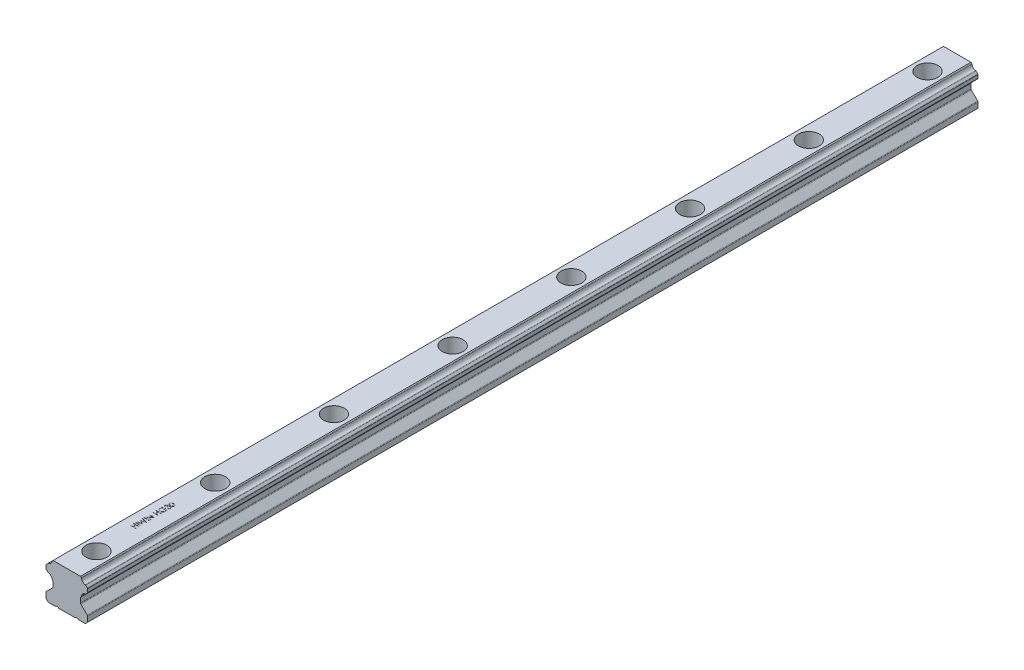
from build123d import *

# Parameters (mm, degrees)
EXTRUDE_1_DEPTH              = 600
HOLE_WIZARD_M8_1_D           = 9
HOLE_WIZARD_M8_1_CBORE_D     = 14
HOLE_WIZARD_M8_1_CBORE_DEPTH = 12
PATTERN_LINEAR_1_COUNT       = 8
PATTERN_LINEAR_1_PITCH       = 80
SKETCH_6_W                   = 3.5
SKETCH_6_H                   = 0.314102564
CUT_EXTRUDE_1_DEPTH          = 0.1


with BuildPart() as part:
    # 草图1 → 凸台-拉伸1 (new body)
    with BuildSketch(Plane.XY):
        with BuildLine():
            Line((13.824264069, 21.431566452), (12.716556587, 22.539273934))
            ThreePointArc((12.716556587, 22.539273934), (12.556614589, 22.653650602), (12.368284792, 22.710178055))
            ThreePointArc((12.368284792, 22.710178055), (10.725602827, 23.516275827), (9.919505055, 25.158957792))
            ThreePointArc((9.919505055, 25.158957792), (9.862977602, 25.347287589), (9.748600934, 25.507229587))
            Line((9.748600934, 25.507229587), (9.255830521, 26))
            Line((9.255830521, 26), (-9.255830521, 26))
            Line((-9.255830521, 26), (-9.748600934, 25.507229587))
            ThreePointArc((-9.748600934, 25.507229587), (-9.862977602, 25.347287589), (-9.919505055, 25.158957792))
            ThreePointArc((-9.919505055, 25.158957792), (-10.725602827, 23.516275827), (-12.368284792, 22.710178055))
            ThreePointArc((-12.368284792, 22.710178055), (-12.556614589, 22.653650602), (-12.716556587, 22.539273934))
            Line((-12.716556587, 22.539273934), (-13.824264069, 21.431566452))
            ThreePointArc((-13.824264069, 21.431566452), (-13.95432772, 21.236912443), (-14, 21.007302383))
            Line((-14, 21.007302383), (-14, 18.986847592))
            ThreePointArc((-14, 18.986847592), (-13.95432772, 18.757237533), (-13.824264069, 18.562583524))
            Line((-13.824264069, 18.562583524), (-12.722974973, 17.461294428))
            ThreePointArc((-12.722974973, 17.461294428), (-12.562524861, 17.346668715), (-12.373580428, 17.290248027))
            ThreePointArc((-12.373580428, 17.290248027), (-10.725602827, 16.483479173), (-9.918833973, 14.835501572))
            ThreePointArc((-9.918833973, 14.835501572), (-9.862413285, 14.646557139), (-9.747787572, 14.486107027))
            Line((-9.747787572, 14.486107027), (-9.534314575, 14.27263403))
            ThreePointArc((-9.534314575, 14.27263403), (-9.360896374, 14.013095351), (-9.3, 13.706948605))
            Line((-9.3, 13.706948605), (-9.3, 10.472470505))
            ThreePointArc((-9.3, 10.472470505), (-9.360896374, 10.166323759), (-9.534314575, 9.90678508))
            Line((-9.534314575, 9.90678508), (-13.765685425, 5.67541423))
            ThreePointArc((-13.765685425, 5.67541423), (-13.939103626, 5.415875551), (-14, 5.109728805))
            Line((-14, 5.109728805), (-14, 1.5))
            Line((-14, 1.5), (-12.5, 0))
            Line((-12.5, 0), (-7.75, 0))
            Line((-7.75, 0), (-7.25, 0.5))
            Line((-7.25, 0.5), (-6.05, 0.5))
            Line((-6.05, 0.5), (-5.55, 0))
            Line((-5.55, 0), (5.55, 0))
            Line((5.55, 0), (6.05, 0.5))
            Line((6.05, 0.5), (7.25, 0.5))
            Line((7.25, 0.5), (7.75, 0))
            Line((7.75, 0), (12.5, 0))
            Line((12.5, 0), (14, 1.5))
            Line((14, 1.5), (14, 5.109728805))
            ThreePointArc((14, 5.109728805), (13.939103626, 5.415875551), (13.765685425, 5.67541423))
            Line((13.765685425, 5.67541423), (9.534314575, 9.90678508))
            ThreePointArc((9.534314575, 9.90678508), (9.360896374, 10.166323759), (9.3, 10.472470505))
            Line((9.3, 10.472470505), (9.3, 13.706948605))
            ThreePointArc((9.3, 13.706948605), (9.360896374, 14.013095351), (9.534314575, 14.27263403))
            Line((9.534314575, 14.27263403), (9.747787572, 14.486107027))
            ThreePointArc((9.747787572, 14.486107027), (9.862413285, 14.646557139), (9.918833973, 14.835501572))
            ThreePointArc((9.918833973, 14.835501572), (10.725602827, 16.483479173), (12.373580428, 17.290248027))
            ThreePointArc((12.373580428, 17.290248027), (12.562524861, 17.346668715), (12.722974973, 17.461294428))
            Line((12.722974973, 17.461294428), (13.824264069, 18.562583524))
            ThreePointArc((13.824264069, 18.562583524), (13.95432772, 18.757237533), (14, 18.986847592))
            Line((14, 18.986847592), (14, 21.007302383))
            ThreePointArc((14, 21.007302383), (13.95432772, 21.236912443), (13.824264069, 21.431566452))
        make_face()
    extrude(amount=-EXTRUDE_1_DEPTH)

    # M8 六角凹头螺钉的柱形沉头孔1 (through all)
    with Locations(Plane(origin=(-4.520582573, 26, -44.994906709), x_dir=(-1, 0, 0), z_dir=(0, 1, 0))):
        with Locations((-4.520582573, 24.994906709)):
            hole_wizard_m8_1 = CounterBoreHole(HOLE_WIZARD_M8_1_D / 2, HOLE_WIZARD_M8_1_CBORE_D / 2, HOLE_WIZARD_M8_1_CBORE_DEPTH)

    # 阵列(线性)1: M8 六角凹头螺钉的柱形沉头孔1 ×8
    with Locations(*[(0, 0, -i * PATTERN_LINEAR_1_PITCH) for i in range(1, PATTERN_LINEAR_1_COUNT)]):
        add(hole_wizard_m8_1, mode=Mode.SUBTRACT)

    # 草图6 → 切除-拉伸1 (cut)
    # profile 1 of 9: a face of its own
    with BuildSketch(Plane(origin=(0, 26, 0), x_dir=(1, 0, 0), z_dir=(0, 1, 0))):
        Polygon((-3.5, 46.403846154), (-3.5, 46.717948718), (-2.064102564, 46.717948718), (-2.064102564, 48.512820513), (-3.5, 48.512820513), (-3.5, 48.826923077), (0, 48.826923077), (0, 48.512820513), (-1.705128205, 48.512820513), (-1.705128205, 46.717948718), (0, 46.717948718), (0, 46.403846154), align=None)
    # profile 2 of 9: a face of its own
    with BuildSketch(Plane(origin=(0, 26, 0), x_dir=(1, 0, 0), z_dir=(0, 1, 0))):
        with Locations((-1.75, 49.881410256)):
            Rectangle(SKETCH_6_W, SKETCH_6_H)
    # profile 3 of 9: a face of its own
    with BuildSketch(Plane(origin=(0, 26, 0), x_dir=(1, 0, 0), z_dir=(0, 1, 0))):
        Polygon((-3.5, 50.576923077), (-3.5, 50.901542468), (-0.933193109, 51.586538462), (-3.5, 52.605268429), (-3.5, 52.650841346), (-0.950721154, 53.650641026), (-3.5, 54.339142628), (-3.5, 54.66025641), (0, 53.716546474), (0, 53.671674679), (-2.676883013, 52.618589744), (0, 51.552884615), (0, 51.508012821), align=None)
    # profile 4 of 9: a face of its own
    with BuildSketch(Plane(origin=(0, 26, 0), x_dir=(1, 0, 0), z_dir=(0, 1, 0))):
        with Locations((-1.75, 55.625)):
            Rectangle(SKETCH_6_W, SKETCH_6_H)
    # profile 5 of 9: a face of its own
    with BuildSketch(Plane(origin=(0, 26, 0), x_dir=(1, 0, 0), z_dir=(0, 1, 0))):
        Polygon((0, 56.544871795), (-3.5, 56.544871795), (-3.5, 56.610777244), (-0.745292468, 58.923076923), (-3.5, 58.923076923), (-3.5, 59.237179487), (0, 59.237179487), (0, 59.165665064), (-2.748397436, 56.858974359), (0, 56.858974359), align=None)
    # profile 6 of 9: a face of its own
    with BuildSketch(Plane(origin=(0, 26, 0), x_dir=(1, 0, 0), z_dir=(0, 1, 0))):
        Polygon((-3.5, 61.480769231), (-3.5, 61.794871795), (-2.064102564, 61.794871795), (-2.064102564, 63.58974359), (-3.5, 63.58974359), (-3.5, 63.903846154), (0, 63.903846154), (0, 63.58974359), (-1.705128205, 63.58974359), (-1.705128205, 61.794871795), (0, 61.794871795), (0, 61.480769231), align=None)
    # profile 7 of 9: a face of its own
    with BuildSketch(Plane(origin=(0, 26, 0), x_dir=(1, 0, 0), z_dir=(0, 1, 0))):
        with BuildLine():
            Line((-2.902644231, 68.076923077), (-2.647435897, 67.807692308))
            add(Edge.make_bspline(
                [(-2.647435897, 67.807692308), (-2.69328212, 67.758983227), (-2.783881335, 67.662726562), (-2.901244074, 67.50552662), (-3.002777003, 67.342170767), (-3.084772592, 67.172394867), (-3.149094254, 67.000650867), (-3.195850217, 66.829891913), (-3.225460377, 66.661223615), (-3.229016796, 66.549059313), (-3.230769231, 66.493790064)],
                knots=[0, 0, 0, 0, 1.089067066, 2.152164705, 3.18986567, 4.218445106, 5.218487318, 6.173592265, 7.100032889, 8, 8, 8, 8], degree=3))
            add(Edge.make_bspline(
                [(-3.230769231, 66.493790064), (-3.230355625, 66.459875364), (-3.229529486, 66.392133924), (-3.218985271, 66.29151198), (-3.203820407, 66.191945342), (-3.181878529, 66.093621968), (-3.15406947, 65.99635068), (-3.119284004, 65.900469793), (-3.078728771, 65.805800421), (-3.031866252, 65.713234402), (-2.980386575, 65.623493669), (-2.923337414, 65.538737672), (-2.862550889, 65.458421211), (-2.796491613, 65.384072004), (-2.725807311, 65.31519549), (-2.651770944, 65.250524789), (-2.572926872, 65.191265211), (-2.489599321, 65.138479571), (-2.403726867, 65.090811977), (-2.316037795, 65.049619777), (-2.227346143, 65.013809823), (-2.136984078, 64.986535862), (-2.045883197, 64.963434988), (-1.953566086, 64.947353752), (-1.859791669, 64.938257435), (-1.796993971, 64.936686944), (-1.765424679, 64.935897436)],
                knots=[0, 0, 0, 0, 1.028150113, 2.053633673, 3.06513288, 4.081487945, 5.106702018, 6.131327874, 7.172780699, 8.228344599, 9.276313556, 10.308389736, 11.324843658, 12.329040066, 13.321460474, 14.316307835, 15.308626991, 16.309440696, 17.305625405, 18.28535951, 19.246194545, 20.203493668, 21.145557131, 22.095268976, 23.042464743, 24, 24, 24, 24], degree=3))
            add(Edge.make_bspline(
                [(-1.765424679, 64.935897436), (-1.733154018, 64.936653631), (-1.668700816, 64.938163957), (-1.572504414, 64.947817154), (-1.477747832, 64.965772364), (-1.384282029, 64.989584114), (-1.291920993, 65.019856789), (-1.20076111, 65.057049303), (-1.110811241, 65.101355435), (-1.022964324, 65.152526704), (-0.937464192, 65.209036172), (-0.856251713, 65.271187356), (-0.780271995, 65.339084893), (-0.708415252, 65.411483836), (-0.641134974, 65.489043832), (-0.579242122, 65.572517364), (-0.521779643, 65.660735956), (-0.469378807, 65.753738745), (-0.42257144, 65.850542725), (-0.38094723, 65.949799156), (-0.346667976, 66.051827058), (-0.31872985, 66.156089724), (-0.295829559, 66.262463002), (-0.281097077, 66.371486803), (-0.270406246, 66.482359512), (-0.269624576, 66.557098144), (-0.269230769, 66.594751603)],
                knots=[0, 0, 0, 0, 0.935915162, 1.869274651, 2.799799983, 3.730201895, 4.664668062, 5.616159355, 6.583070886, 7.570012957, 8.562524459, 9.553461134, 10.53281078, 11.515274572, 12.509912756, 13.507571325, 14.526460018, 15.561318395, 16.601025881, 17.643204557, 18.680545676, 19.719612342, 20.772381578, 21.833430283, 22.908478249, 24, 24, 24, 24], degree=3))
            add(Edge.make_bspline(
                [(-0.269230769, 66.594751603), (-0.270178952, 66.640130135), (-0.272040863, 66.729238255), (-0.286546735, 66.860222075), (-0.309173205, 66.986034693), (-0.342412256, 67.106266531), (-0.384484705, 67.221353926), (-0.436513285, 67.330872414), (-0.497950569, 67.435124408), (-0.567552463, 67.533658668), (-0.645100929, 67.624132689), (-0.728035637, 67.706474768), (-0.817431068, 67.77785339), (-0.911954918, 67.840400707), (-1.012511326, 67.892097951), (-1.118540888, 67.934543829), (-1.230109213, 67.967076285), (-1.307200733, 67.980431374), (-1.346153846, 67.987179487)],
                knots=[0, 0, 0, 0, 1.130199668, 2.219330667, 3.279027493, 4.311506524, 5.322739849, 6.327972234, 7.327472899, 8.33386792, 9.329086447, 10.29244429, 11.240784345, 12.174119183, 13.111530729, 14.052100829, 15.015757696, 16, 16, 16, 16], degree=3))
            Line((-1.346153846, 67.987179487), (-1.346153846, 66.820512821))
            Line((-1.346153846, 66.820512821), (-1.705128205, 66.820512821))
            Line((-1.705128205, 66.820512821), (-1.705128205, 68.301282051))
            add(Edge.make_bspline(
                [(-1.705128205, 68.301282051), (-1.638220716, 68.299576203), (-1.507270675, 68.296237549), (-1.316300404, 68.272818634), (-1.13592871, 68.235002122), (-0.965965639, 68.18334181), (-0.806652046, 68.116466529), (-0.65782618, 68.035094001), (-0.520449499, 67.93792188), (-0.393400495, 67.828411438), (-0.280071283, 67.705511481), (-0.180465345, 67.572542861), (-0.09656273, 67.429285892), (-0.028302067, 67.275876085), (0.024971927, 67.112815651), (0.062743504, 66.939727272), (0.085373467, 66.756845671), (0.088264847, 66.631508994), (0.08974359, 66.567407853)],
                knots=[0, 0, 0, 0, 1.140356446, 2.231883559, 3.274166699, 4.278491846, 5.25512956, 6.21435461, 7.1637429, 8.11826594, 9.068280886, 10.0076534, 10.945064095, 11.891975133, 12.864533718, 13.863980011, 14.907571808, 16, 16, 16, 16], degree=3))
            add(Edge.make_bspline(
                [(0.08974359, 66.567407853), (0.089174469, 66.527897717), (0.088051978, 66.449970996), (0.080074631, 66.334880068), (0.067794054, 66.222962448), (0.049248931, 66.114234439), (0.026534277, 66.008296097), (-0.002552442, 65.905676512), (-0.036221141, 65.80598477), (-0.074516815, 65.709066784), (-0.118888472, 65.615802237), (-0.168198111, 65.52577572), (-0.222191472, 65.438489595), (-0.281802318, 65.35453843), (-0.346584778, 65.273484808), (-0.416668697, 65.195851364), (-0.491839816, 65.121203486), (-0.545218826, 65.074443023), (-0.572115385, 65.05088141)],
                knots=[0, 0, 0, 0, 1.107784379, 2.184907829, 3.233506516, 4.263428166, 5.276301166, 6.270063455, 7.25232949, 8.225834625, 9.190232166, 10.146266622, 11.1027726, 12.066435141, 13.031522626, 14.010570082, 14.99756817, 16, 16, 16, 16], degree=3))
            add(Edge.make_bspline(
                [(-0.572115385, 65.05088141), (-0.614786038, 65.016695478), (-0.699419055, 64.948891066), (-0.835018999, 64.861612909), (-0.975420859, 64.787211506), (-1.121015488, 64.726843684), (-1.271666701, 64.679705598), (-1.427181992, 64.645899345), (-1.587761622, 64.626092056), (-1.696426887, 64.623238518), (-1.751402244, 64.621794872)],
                knots=[0, 0, 0, 0, 1.023165419, 2.029347347, 3.013907458, 3.994755782, 4.975994455, 5.96558838, 6.970761222, 8, 8, 8, 8], degree=3))
            add(Edge.make_bspline(
                [(-1.751402244, 64.621794872), (-1.792568496, 64.62232711), (-1.874377804, 64.623384821), (-1.99583511, 64.636210339), (-2.115135808, 64.654611751), (-2.232182344, 64.681658827), (-2.347053012, 64.715755013), (-2.45980069, 64.758308794), (-2.570493643, 64.807852572), (-2.67836343, 64.865442289), (-2.782003044, 64.929511026), (-2.880905313, 64.999118682), (-2.973467332, 65.074802367), (-3.059903521, 65.156782462), (-3.141494975, 65.243406392), (-3.216537375, 65.336492693), (-3.286205011, 65.434631029), (-3.349159221, 65.538582169), (-3.405727075, 65.6467058), (-3.455315154, 65.758766886), (-3.496298775, 65.874724704), (-3.531072472, 65.993712261), (-3.556787635, 66.11662974), (-3.575436374, 66.242585283), (-3.588196976, 66.372235393), (-3.589223231, 66.459871423), (-3.58974359, 66.504306891)],
                knots=[0, 0, 0, 0, 1.00895651, 2.005089799, 2.991467152, 3.967318338, 4.948153826, 5.927364234, 6.919980553, 7.91976625, 8.923240147, 9.905815003, 10.88314567, 11.851989312, 12.825009789, 13.798721852, 14.781296708, 15.773896486, 16.776076962, 17.771600213, 18.775744723, 19.78957137, 20.808953803, 21.851964491, 22.910847925, 24, 24, 24, 24], degree=3))
            add(Edge.make_bspline(
                [(-3.58974359, 66.504306891), (-3.589164098, 66.540545135), (-3.588015034, 66.612401313), (-3.580050386, 66.719327046), (-3.567426505, 66.82460006), (-3.550199718, 66.92837645), (-3.526736028, 67.030302816), (-3.498657743, 67.130669522), (-3.46596592, 67.229622058), (-3.426977074, 67.326850307), (-3.382723449, 67.423008023), (-3.332910027, 67.518629864), (-3.276685022, 67.61338911), (-3.213881487, 67.707450091), (-3.145578069, 67.801405949), (-3.069821245, 67.893770591), (-2.989598489, 67.986773536), (-2.931916305, 68.04657535), (-2.902644231, 68.076923077)],
                knots=[0, 0, 0, 0, 0.985871117, 1.954866573, 2.915460327, 3.869826059, 4.81536089, 5.759505086, 6.70452669, 7.649098992, 8.607881297, 9.583363685, 10.581137262, 11.603961102, 12.659522466, 13.73993555, 14.853081303, 16, 16, 16, 16], degree=3))
        make_face()
    # profile 8 of 9: a face of its own
    with BuildSketch(Plane(origin=(0, 26, 0), x_dir=(1, 0, 0), z_dir=(0, 1, 0))):
        with BuildLine():
            Line((-2.692307692, 69.153846154), (-2.692307692, 68.83974359))
            add(Edge.make_bspline(
                [(-2.692307692, 68.83974359), (-2.727540176, 68.84825314), (-2.796416801, 68.864888616), (-2.894824062, 68.899586189), (-2.987947583, 68.937385445), (-3.074043657, 68.982774549), (-3.154842559, 69.032283303), (-3.228511684, 69.089006025), (-3.296924649, 69.150325748), (-3.357637887, 69.218150697), (-3.412615616, 69.289279358), (-3.459490673, 69.364713978), (-3.499814826, 69.442936872), (-3.533035058, 69.524490005), (-3.558060582, 69.609616177), (-3.576217387, 69.6975458), (-3.588008502, 69.7885093), (-3.589159265, 69.850256891), (-3.58974359, 69.881610577)],
                knots=[0, 0, 0, 0, 1.162005537, 2.271625781, 3.343758855, 4.383309926, 5.390229558, 6.379919256, 7.361854164, 8.333198761, 9.295911338, 10.242430842, 11.177959212, 12.116337295, 13.062827104, 14.020064771, 14.994644689, 16, 16, 16, 16], degree=3))
            add(Edge.make_bspline(
                [(-3.58974359, 69.881610577), (-3.588364359, 69.927293319), (-3.585635984, 70.01766233), (-3.560721548, 70.150425377), (-3.521296415, 70.278452196), (-3.466822688, 70.400341444), (-3.399635375, 70.513559876), (-3.319670638, 70.614296063), (-3.228471337, 70.701184574), (-3.127738772, 70.774078952), (-3.020083263, 70.831153951), (-2.909283106, 70.873240324), (-2.795601134, 70.898862005), (-2.718843855, 70.902182562), (-2.680388622, 70.903846154)],
                knots=[0, 0, 0, 0, 1.083050992, 2.142477498, 3.193116406, 4.255571735, 5.30263384, 6.308962982, 7.297363603, 8.282367274, 9.249857812, 10.179914175, 11.08814088, 12, 12, 12, 12], degree=3))
            add(Edge.make_bspline(
                [(-2.680388622, 70.903846154), (-2.643381827, 70.902682563), (-2.570965273, 70.900405596), (-2.465243775, 70.88107189), (-2.365602175, 70.848535627), (-2.271621013, 70.803465865), (-2.183896173, 70.745124314), (-2.102230282, 70.674451618), (-2.026261124, 70.590948956), (-1.982741651, 70.527670018), (-1.960336538, 70.495092147)],
                knots=[0, 0, 0, 0, 1.024540389, 2.004866551, 2.965041327, 3.920577974, 4.882998113, 5.874504559, 6.905732034, 8, 8, 8, 8], degree=3))
            add(Edge.make_bspline(
                [(-1.960336538, 70.495092147), (-1.942423541, 70.532371359), (-1.906875194, 70.606351961), (-1.836051735, 70.706173383), (-1.75628694, 70.79817187), (-1.693344586, 70.848874652), (-1.661658654, 70.874399038)],
                knots=[0, 0, 0, 0, 1.015663554, 2.015584519, 3.001021554, 4, 4, 4, 4], degree=3))
            add(Edge.make_bspline(
                [(-1.661658654, 70.874399038), (-1.638600902, 70.891240381), (-1.592862986, 70.924647277), (-1.51932656, 70.965882811), (-1.444975071, 71.003291925), (-1.367815664, 71.032442144), (-1.288742651, 71.055016011), (-1.207620255, 71.071152043), (-1.124382232, 71.081176184), (-1.068069752, 71.082611736), (-1.039763622, 71.083333333)],
                knots=[0, 0, 0, 0, 1.025084078, 2.033381695, 3.024893161, 4.013698104, 4.991890475, 5.976764909, 6.982997093, 8, 8, 8, 8], degree=3))
            add(Edge.make_bspline(
                [(-1.039763622, 71.083333333), (-0.990754151, 71.081538561), (-0.892965849, 71.077957463), (-0.74848737, 71.045957268), (-0.60727652, 70.996328902), (-0.47214511, 70.925930361), (-0.345832955, 70.839746222), (-0.231982837, 70.738346794), (-0.135655914, 70.620282446), (-0.054197152, 70.489832037), (0.01031173, 70.347893086), (0.056807387, 70.196698141), (0.084695443, 70.037122187), (0.088041716, 69.927996169), (0.08974359, 69.872495994)],
                knots=[0, 0, 0, 0, 0.955697303, 1.906897079, 2.875188111, 3.870982192, 4.871999088, 5.854111427, 6.836107184, 7.836239895, 8.848948182, 9.870701427, 10.917064451, 12, 12, 12, 12], degree=3))
            add(Edge.make_bspline(
                [(0.08974359, 69.872495994), (0.088867804, 69.835079049), (0.087144549, 69.761454978), (0.075573795, 69.653177935), (0.053866216, 69.550041451), (0.02656593, 69.45104403), (-0.011179774, 69.357679783), (-0.056179646, 69.268605754), (-0.109587649, 69.184212384), (-0.171493598, 69.105000859), (-0.240788051, 69.031055805), (-0.318622183, 68.964261099), (-0.403543338, 68.903877726), (-0.496315397, 68.850289356), (-0.596678518, 68.803270455), (-0.705034874, 68.763832876), (-0.820544439, 68.729398997), (-0.901018589, 68.713358268), (-0.942307692, 68.705128205)],
                knots=[0, 0, 0, 0, 1.048603596, 2.063302207, 3.045874044, 3.999447474, 4.937100059, 5.862643889, 6.7929026, 7.7308982, 8.676022965, 9.627908155, 10.600123445, 11.591992905, 12.626222643, 13.701663232, 14.820785756, 16, 16, 16, 16], degree=3))
            Line((-0.942307692, 68.705128205), (-0.942307692, 69.019230769))
            add(Edge.make_bspline(
                [(-0.942307692, 69.019230769), (-0.915358679, 69.027414061), (-0.862940507, 69.043331273), (-0.787500202, 69.070425571), (-0.718342149, 69.101293843), (-0.654959027, 69.134408402), (-0.596726624, 69.169186848), (-0.545184755, 69.208101773), (-0.498069553, 69.248270918), (-0.471524941, 69.278550272), (-0.458533654, 69.293369391)],
                knots=[0, 0, 0, 0, 1.198163088, 2.33053128, 3.407730985, 4.417276592, 5.372219308, 6.28897303, 7.162600585, 8, 8, 8, 8], degree=3))
            add(Edge.make_bspline(
                [(-0.458533654, 69.293369391), (-0.44343155, 69.312968156), (-0.413273959, 69.35210519), (-0.374678832, 69.415840572), (-0.341642326, 69.48310519), (-0.31478887, 69.554459985), (-0.294631697, 69.629914528), (-0.280123513, 69.709162744), (-0.270545857, 69.792334659), (-0.269675525, 69.849097866), (-0.269230769, 69.878104968)],
                knots=[0, 0, 0, 0, 0.946083416, 1.889246487, 2.84504177, 3.809995578, 4.801312957, 5.829064617, 6.89060985, 8, 8, 8, 8], degree=3))
            add(Edge.make_bspline(
                [(-0.269230769, 69.878104968), (-0.269846674, 69.910858471), (-0.271051024, 69.974905118), (-0.282126731, 70.068359977), (-0.298257144, 70.157267424), (-0.323170127, 70.24064035), (-0.353950979, 70.319570858), (-0.392599384, 70.392952507), (-0.437944106, 70.461748613), (-0.489483264, 70.525078019), (-0.545904759, 70.582023526), (-0.60491783, 70.63216304), (-0.66627366, 70.674787701), (-0.730311781, 70.709171279), (-0.79676701, 70.736321829), (-0.865825839, 70.75480503), (-0.936923105, 70.767656545), (-0.985252074, 70.768703157), (-1.009615385, 70.769230769)],
                knots=[0, 0, 0, 0, 1.217147791, 2.380027433, 3.494444702, 4.572153297, 5.609568379, 6.639424714, 7.649109417, 8.668170816, 9.669597737, 10.625200337, 11.543417969, 12.441394052, 13.322311151, 14.205496177, 15.095365482, 16, 16, 16, 16], degree=3))
            add(Edge.make_bspline(
                [(-1.009615385, 70.769230769), (-1.042224638, 70.767697248), (-1.107280885, 70.764637835), (-1.2030297, 70.741377488), (-1.295316283, 70.702773106), (-1.38294536, 70.649787861), (-1.463170576, 70.583711244), (-1.535262402, 70.50766728), (-1.594692546, 70.419587186), (-1.635791228, 70.338580334), (-1.663826853, 70.266813294), (-1.68250216, 70.205398354), (-1.698315711, 70.136641615), (-1.713028014, 70.061375308), (-1.725549353, 69.979032079), (-1.735991171, 69.889701645), (-1.744346211, 69.793365882), (-1.748077307, 69.726674716), (-1.75, 69.692307692)],
                knots=[0, 0, 0, 0, 1.070505987, 2.135685285, 3.216438728, 4.346150463, 5.486482244, 6.621737109, 7.7759408, 8.963942283, 9.59839197, 10.305095457, 11.070459627, 11.915156775, 12.823989992, 13.805807174, 14.869297358, 16, 16, 16, 16], degree=3))
            Line((-1.75, 69.692307692), (-2.108974359, 69.692307692))
            add(Edge.make_bspline(
                [(-2.108974359, 69.692307692), (-2.109815076, 69.73559321), (-2.111461258, 69.820349257), (-2.127376172, 69.944483988), (-2.152925868, 70.062682625), (-2.189431972, 70.173246032), (-2.232431754, 70.273826023), (-2.282116815, 70.361437758), (-2.338352279, 70.433774821), (-2.400061459, 70.49159294), (-2.465885585, 70.535538773), (-2.534911696, 70.567143345), (-2.607413433, 70.585979698), (-2.65691109, 70.588484541), (-2.681790865, 70.58974359)],
                knots=[0, 0, 0, 0, 1.322091412, 2.58874672, 3.817242262, 5.011895168, 6.140903042, 7.155122731, 8.080855046, 8.929742606, 9.727943956, 10.488587771, 11.240295418, 12, 12, 12, 12], degree=3))
            add(Edge.make_bspline(
                [(-2.681790865, 70.58974359), (-2.700071652, 70.589338248), (-2.73644041, 70.58853184), (-2.789741053, 70.577957798), (-2.841409956, 70.562798788), (-2.890858006, 70.540789728), (-2.938186405, 70.512273586), (-2.983914344, 70.477877516), (-3.027450953, 70.436621217), (-3.069020841, 70.390413715), (-3.106837935, 70.339246935), (-3.13993415, 70.284314422), (-3.168009957, 70.225838922), (-3.191238499, 70.16419501), (-3.208692545, 70.09909542), (-3.221229855, 70.03087), (-3.229067101, 69.959382), (-3.230195574, 69.910610312), (-3.230769231, 69.885817308)],
                knots=[0, 0, 0, 0, 0.884325644, 1.759323928, 2.622595547, 3.489424008, 4.37295195, 5.294616785, 6.255907374, 7.274251867, 8.302369084, 9.333474657, 10.37669385, 11.44084034, 12.520297356, 13.637342342, 14.798947025, 16, 16, 16, 16], degree=3))
            add(Edge.make_bspline(
                [(-3.230769231, 69.885817308), (-3.229377869, 69.84596564), (-3.226660215, 69.768126063), (-3.202857202, 69.655911146), (-3.164879118, 69.551591812), (-3.119546099, 69.471853146), (-3.074795665, 69.412970572), (-3.035713279, 69.370893633), (-2.992280455, 69.329573123), (-2.94182208, 69.291727446), (-2.887755289, 69.25345347), (-2.827331608, 69.218608908), (-2.762127214, 69.184749216), (-2.716031579, 69.164346666), (-2.692307692, 69.153846154)],
                knots=[0, 0, 0, 0, 1.472543308, 2.876219568, 4.221790263, 5.565193594, 6.249813518, 6.953379497, 7.687249741, 8.463570142, 9.283606569, 10.136032583, 11.040678096, 12, 12, 12, 12], degree=3))
        make_face()
    # profile 9 of 9: a face of its own
    with BuildSketch(Plane(origin=(0, 26, 0), x_dir=(1, 0, 0), z_dir=(0, 1, 0))):
        with BuildLine():
            add(Edge.make_bspline(
                [(-1.748597756, 71.397435897), (-1.804695144, 71.397763916), (-1.913665128, 71.398401096), (-2.07244977, 71.405489517), (-2.22141006, 71.417264859), (-2.360553125, 71.433402232), (-2.489914892, 71.45304021), (-2.609149641, 71.479255704), (-2.718809275, 71.509068482), (-2.819251231, 71.543621013), (-2.911829251, 71.582608507), (-2.998253337, 71.625043806), (-3.078399222, 71.672604919), (-3.153522881, 71.722594993), (-3.222476964, 71.776960136), (-3.286055953, 71.834534655), (-3.343723673, 71.89647005), (-3.395519616, 71.962165602), (-3.4409371, 72.031176064), (-3.481188747, 72.101615636), (-3.514343815, 72.174742919), (-3.541465573, 72.249595231), (-3.56360569, 72.326330334), (-3.578813682, 72.404928638), (-3.588365511, 72.485572339), (-3.589279872, 72.540003455), (-3.58974359, 72.567608173)],
                knots=[0, 0, 0, 0, 1.646148282, 3.197666765, 4.66315463, 6.030252048, 7.307778049, 8.501004361, 9.610818041, 10.641065266, 11.615491391, 12.557119604, 13.464013759, 14.348536654, 15.203310953, 16.038349431, 16.863300206, 17.683791446, 18.490318933, 19.285717724, 20.06220424, 20.843281102, 21.620494212, 22.403315558, 23.190242141, 24, 24, 24, 24], degree=3))
            add(Edge.make_bspline(
                [(-3.58974359, 72.567608173), (-3.58935734, 72.595457151), (-3.588588839, 72.650866815), (-3.57777172, 72.732491963), (-3.563809751, 72.812695341), (-3.541417054, 72.890260103), (-3.514621286, 72.966652853), (-3.479264697, 73.039973853), (-3.440811661, 73.112811725), (-3.393902192, 73.18185754), (-3.342059509, 73.249174262), (-3.283204809, 73.31227666), (-3.218966904, 73.372777801), (-3.1479131, 73.42839258), (-3.071132863, 73.481504569), (-2.987982553, 73.530097583), (-2.898646443, 73.575182269), (-2.803538681, 73.617606099), (-2.700118793, 73.654704618), (-2.589031834, 73.687688167), (-2.46927186, 73.714723766), (-2.341506009, 73.737081732), (-2.20510133, 73.754435769), (-2.060334196, 73.767065744), (-1.907114038, 73.773739587), (-1.802356156, 73.774996182), (-1.748597756, 73.775641026)],
                knots=[0, 0, 0, 0, 0.810910589, 1.61342667, 2.396193133, 3.181089899, 3.963115317, 4.752255436, 5.550715454, 6.36105385, 7.181178335, 8.024612154, 8.872680183, 9.750181803, 10.651284446, 11.591556747, 12.554036451, 13.566402641, 14.62422919, 15.753422176, 16.94128843, 18.199818041, 19.531985927, 20.947085226, 22.433341622, 24, 24, 24, 24], degree=3))
            add(Edge.make_bspline(
                [(-1.748597756, 73.775641026), (-1.695074317, 73.774981995), (-1.590552634, 73.773695025), (-1.438014706, 73.767208879), (-1.294027899, 73.754127277), (-1.1584387, 73.738002556), (-1.031184245, 73.715394698), (-0.912347453, 73.688154098), (-0.801507589, 73.657117486), (-0.699458804, 73.619449605), (-0.604516084, 73.578013224), (-0.515836856, 73.532976917), (-0.432708505, 73.484658121), (-0.355725748, 73.432342688), (-0.284957142, 73.375813103), (-0.220498913, 73.315354368), (-0.161269873, 73.251701012), (-0.108856037, 73.183991846), (-0.061589422, 73.114302911), (-0.021740947, 73.041457639), (0.012785419, 72.967320338), (0.041013907, 72.891150816), (0.06290543, 72.813066674), (0.07795466, 72.732808325), (0.088533112, 72.650855296), (0.0893387, 72.595453298), (0.08974359, 72.567608173)],
                knots=[0, 0, 0, 0, 1.561645053, 3.049612875, 4.452756685, 5.778837748, 7.032101753, 8.221335837, 9.334924186, 10.387562255, 11.392109817, 12.355697819, 13.287721948, 14.19548756, 15.068665045, 15.927346723, 16.771751757, 17.602390507, 18.423119567, 19.225778204, 20.022010933, 20.807278863, 21.593079439, 22.384715467, 23.188155646, 24, 24, 24, 24], degree=3))
            add(Edge.make_bspline(
                [(0.08974359, 72.567608173), (0.089277234, 72.540004059), (0.088357672, 72.485574134), (0.078843941, 72.404921709), (0.063548437, 72.326639266), (0.042131835, 72.250340509), (0.015916991, 72.175634006), (-0.018236662, 72.103537674), (-0.057570846, 72.033250161), (-0.10236583, 71.964957956), (-0.153689187, 71.899948274), (-0.210447097, 71.837840224), (-0.274095026, 71.780251507), (-0.343630904, 71.726357759), (-0.418866334, 71.6758392), (-0.499851805, 71.628689078), (-0.586725603, 71.585363879), (-0.680035274, 71.545710289), (-0.781190123, 71.510552958), (-0.891129288, 71.47961794), (-1.010969427, 71.45491109), (-1.140102086, 71.433968216), (-1.278789653, 71.417186417), (-1.427082304, 71.405494406), (-1.584698442, 71.398406477), (-1.692967691, 71.397765328), (-1.748597756, 71.397435897)],
                knots=[0, 0, 0, 0, 0.810927267, 1.598990287, 2.382942141, 3.152806972, 3.926217614, 4.706701772, 5.493896336, 6.292070767, 7.104102563, 7.925577746, 8.761822141, 9.623241997, 10.509042271, 11.423174113, 12.375371989, 13.360203808, 14.400680605, 15.520553799, 16.714061498, 17.994519714, 19.364400916, 20.818312473, 22.365209998, 24, 24, 24, 24], degree=3))
        make_face()
        with BuildLine():
            add(Edge.make_bspline(
                [(-1.75, 71.711538462), (-1.703251488, 71.711660528), (-1.612521806, 71.711897434), (-1.480908982, 71.717907342), (-1.357947449, 71.72627252), (-1.243685198, 71.736796396), (-1.138521571, 71.752557397), (-1.042019366, 71.770439215), (-0.954357206, 71.791887366), (-0.874769028, 71.817389509), (-0.802127831, 71.846438931), (-0.73449747, 71.878100108), (-0.6710764, 71.912414612), (-0.612018488, 71.950085815), (-0.558045653, 71.991858505), (-0.507789808, 72.035796093), (-0.462998805, 72.083877944), (-0.409270042, 72.150378729), (-0.353751809, 72.2381766), (-0.305405447, 72.348796634), (-0.275023059, 72.46246519), (-0.271159294, 72.539616426), (-0.269230769, 72.578125)],
                knots=[0, 0, 0, 0, 1.459098681, 2.831824031, 4.11146945, 5.306290378, 6.412266529, 7.42953815, 8.369053297, 9.227277979, 10.03601793, 10.809473603, 11.557037441, 12.285528272, 12.993193355, 13.685654407, 14.36688038, 15.041354379, 16.352855396, 17.594313975, 18.799247529, 20, 20, 20, 20], degree=3))
            add(Edge.make_bspline(
                [(-0.269230769, 72.578125), (-0.270919423, 72.616856485), (-0.274290741, 72.694182066), (-0.303714275, 72.807746207), (-0.351547596, 72.917082693), (-0.406196032, 73.003369889), (-0.458572725, 73.068833488), (-0.503177405, 73.115754383), (-0.553136043, 73.158815346), (-0.607034569, 73.199657723), (-0.665907268, 73.237116714), (-0.729469782, 73.271179876), (-0.797898977, 73.302263217), (-0.845668714, 73.319972264), (-0.870092147, 73.329026442)],
                knots=[0, 0, 0, 0, 1.353621445, 2.702441307, 4.075953605, 5.516772412, 6.261413105, 7.007624062, 7.778524365, 8.566925914, 9.372323995, 10.217594641, 11.088702136, 12, 12, 12, 12], degree=3))
            add(Edge.make_bspline(
                [(-0.870092147, 73.329026442), (-0.901321887, 73.33957821), (-0.964731651, 73.361002824), (-1.063095303, 73.388614598), (-1.166298067, 73.410359997), (-1.273723184, 73.429923363), (-1.386162885, 73.443276419), (-1.503269269, 73.454024232), (-1.625130631, 73.460354919), (-1.707925622, 73.46113967), (-1.75, 73.461538462)],
                knots=[0, 0, 0, 0, 0.884706709, 1.796334032, 2.740027952, 3.714592787, 4.726048262, 5.777819803, 6.87074269, 8, 8, 8, 8], degree=3))
            add(Edge.make_bspline(
                [(-1.75, 73.461538462), (-1.792067573, 73.460988272), (-1.874360737, 73.459911985), (-1.994878918, 73.455797997), (-2.109346679, 73.445174423), (-2.218257151, 73.433375303), (-2.321007456, 73.415978084), (-2.418457753, 73.397220269), (-2.509400806, 73.372019085), (-2.59526029, 73.345099214), (-2.675061285, 73.31428915), (-2.749173893, 73.280372271), (-2.817962738, 73.244154516), (-2.88121528, 73.204798282), (-2.939298414, 73.162851763), (-2.990875649, 73.116810991), (-3.038455934, 73.069599898), (-3.091796946, 73.002455771), (-3.146613642, 72.915267079), (-3.19568703, 72.806026522), (-3.224729986, 72.692967254), (-3.228757601, 72.61637815), (-3.230769231, 72.578125)],
                knots=[0, 0, 0, 0, 1.313483664, 2.569454835, 3.763100662, 4.901599063, 5.988328865, 7.015709358, 7.99797933, 8.932480776, 9.824041341, 10.666387587, 11.475829342, 12.24921787, 12.990555181, 13.709176526, 14.405678811, 15.080244297, 16.38186033, 17.610124501, 18.806354173, 20, 20, 20, 20], degree=3))
            add(Edge.make_bspline(
                [(-3.230769231, 72.578125), (-3.228752596, 72.539408528), (-3.224715652, 72.46190505), (-3.195821345, 72.347638415), (-3.146757221, 72.237659871), (-3.091902557, 72.150183664), (-3.038660449, 72.083855225), (-2.993345284, 72.03678701), (-2.944289777, 71.992240067), (-2.889838141, 71.951549077), (-2.830988321, 71.914101253), (-2.768387395, 71.878460616), (-2.700630668, 71.847222833), (-2.628046431, 71.818080148), (-2.548453875, 71.792535468), (-2.460474524, 71.771332387), (-2.363741864, 71.752029489), (-2.257809852, 71.738128256), (-2.143523214, 71.725887297), (-2.020247228, 71.717999177), (-1.888182457, 71.711869903), (-1.796983355, 71.711651155), (-1.75, 71.711538462)],
                knots=[0, 0, 0, 0, 1.207546505, 2.417292871, 3.651582144, 4.952510111, 5.626719005, 6.30238548, 6.989136872, 7.692112372, 8.420316868, 9.164734959, 9.937886623, 10.746308695, 11.604196049, 12.543341915, 13.568754172, 14.680483261, 15.875568977, 17.154711427, 18.534182925, 20, 20, 20, 20], degree=3))
        make_face(mode=Mode.SUBTRACT)
    extrude(amount=-CUT_EXTRUDE_1_DEPTH, mode=Mode.SUBTRACT)


solid = part.part
